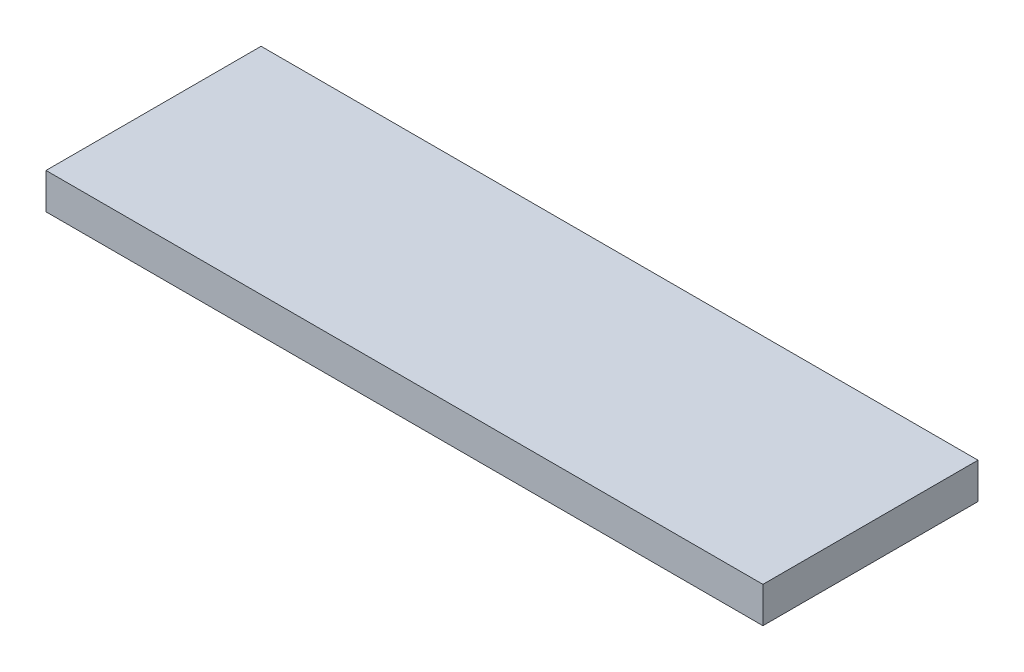
from build123d import *

# Parameters (mm, degrees)
SKETCH1_W  = 127
SKETCH1_H  = 38.1
MAIN_DEPTH = 6.35


with BuildPart() as part:
    # Sketch1 → Main (new body)
    with BuildSketch(Plane(origin=(0, 0, 0), x_dir=(1, 0, 0), z_dir=(0, 1, 0))):
        Rectangle(SKETCH1_W, SKETCH1_H)
    extrude(amount=MAIN_DEPTH)


solid = part.part
